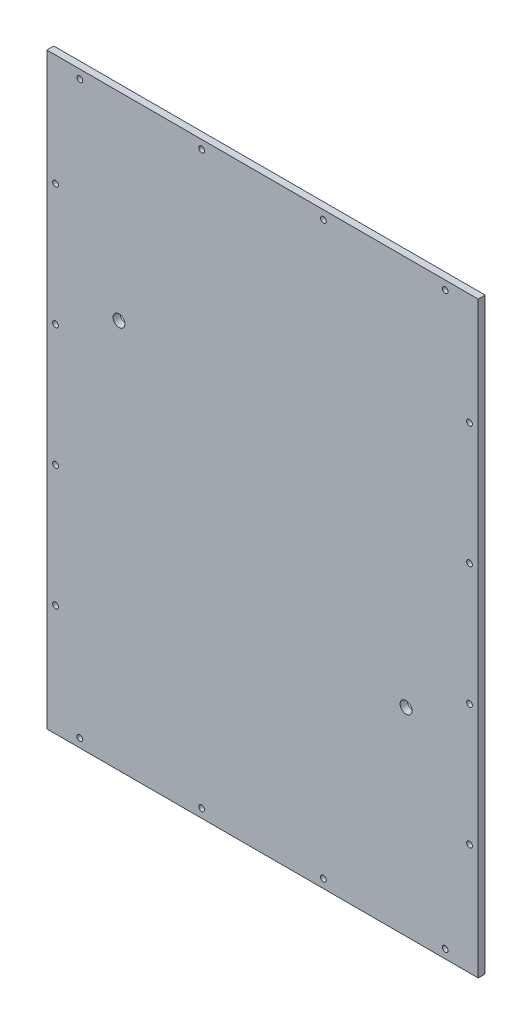
from build123d import *

# Parameters (mm, degrees)
SKETCH1_W                       = 260
SKETCH1_H                       = 350
BOSS_EXTRUDE1_DEPTH             = 58
FILLET1_R                       = 54
SKIZZE1_W                       = 260
SKIZZE1_H                       = 350
SKIZZE1_W_2                     = 248
SKIZZE1_H_2                     = 338
SCHNITT_LINEAR_AUSTRAGEN1_DEPTH = 4
M4_TAPPED_HOLE1_AT_2_COUNT      = 2
M4_TAPPED_HOLE1_AT_2_PITCH      = 70
M4_TAPPED_HOLE1_AT_3_COUNT      = 2
M4_TAPPED_HOLE1_AT_3_PITCH      = 60.638271743
M4_TAPPED_HOLE1_AT_4_COUNT      = 2
M4_TAPPED_HOLE1_AT_4_PITCH      = 129.757466067
SKETCH2_W                       = 260
SKETCH2_H                       = 350
CUT_EXTRUDE1_DEPTH              = 225.590738901
M8_TAPPED_HOLE1_D               = 6.8
CIRPATTERN1_COUNT               = 2


with BuildPart() as part:
    # Sketch1 → Boss-Extrude1 (new body)
    with BuildSketch(Plane.XY):
        Rectangle(SKETCH1_W, SKETCH1_H)
    extrude(amount=BOSS_EXTRUDE1_DEPTH)

    # Fillet1
    fillet1_edges = [part.edges().sort_by_distance(p)[0] for p in [
        (-130, 0, 58),
        (0, -175, 58),
        (130, 0, 58),
        (0, 175, 58),
    ]]
    fillet(fillet1_edges, radius=FILLET1_R)

    # Skizze1 → Schnitt-Linear austragen1 (cut)
    with BuildSketch(Plane(origin=(0, 0, 0), x_dir=(-1, 0, 0), z_dir=(0, 0, -1))):
        Rectangle(SKIZZE1_W, SKIZZE1_H)
        Rectangle(SKIZZE1_W_2, SKIZZE1_H_2, mode=Mode.SUBTRACT)
    extrude(amount=-SCHNITT_LINEAR_AUSTRAGEN1_DEPTH, mode=Mode.SUBTRACT)

    # Skizze2 → M4 Tapped Hole1 (revolve, cut)
    with BuildSketch(Plane(origin=(105, 164, 0), x_dir=(0, 1, 0), z_dir=(1, 0, 0))):
        Polygon((0, 0), (0, 12.491420021), (1.65, 11.5), (1.65, 0), align=None)
    m4_tapped_hole1 = revolve(axis=Axis((105, 164, -6.35), (0, 0, 1)), mode=Mode.SUBTRACT)

    # M4 Tapped Hole1 at 2: M4 Tapped Hole1 ×2
    with Locations(*[(-i * M4_TAPPED_HOLE1_AT_2_PITCH, 0, 0) for i in range(1, M4_TAPPED_HOLE1_AT_2_COUNT)]):
        add(m4_tapped_hole1, mode=Mode.SUBTRACT)

    # M4 Tapped Hole1 at 3: M4 Tapped Hole1 ×2
    with Locations(*[Vector(0.23087729246792194, -0.9729828754005292, 0) * (i * M4_TAPPED_HOLE1_AT_3_PITCH) for i in range(1, M4_TAPPED_HOLE1_AT_3_COUNT)]):
        add(m4_tapped_hole1, mode=Mode.SUBTRACT)

    # M4 Tapped Hole1 at 4: M4 Tapped Hole1 ×2
    with Locations(*[Vector(0.10789359891495286, -0.9941624471449217, 0) * (i * M4_TAPPED_HOLE1_AT_4_PITCH) for i in range(1, M4_TAPPED_HOLE1_AT_4_COUNT)]):
        add(m4_tapped_hole1, mode=Mode.SUBTRACT)

    # Spiegeln1: M4 Tapped Hole1 across plane
    add(m4_tapped_hole1.mirror(Plane.ZX), mode=Mode.SUBTRACT)

    # Spiegeln1 copy 1 sketch → Spiegeln1 copy 1 (revolve, cut)
    with BuildSketch(Plane(origin=(35, -164, 0), x_dir=(0, -1, 0), z_dir=(1, 0, 0))):
        Polygon((0, 0), (0, -12.491420021), (1.65, -11.5), (1.65, 0), align=None)
    revolve(axis=Axis((35, -164, -6.35), (0, 0, -1)), mode=Mode.SUBTRACT)

    # Spiegeln1 copy 2 sketch → Spiegeln1 copy 2 (revolve, cut)
    with BuildSketch(Plane(origin=(119, -105, 0), x_dir=(0, -1, 0), z_dir=(1, 0, 0))):
        Polygon((0, 0), (0, -12.491420021), (1.65, -11.5), (1.65, 0), align=None)
    revolve(axis=Axis((119, -105, -6.35), (0, 0, -1)), mode=Mode.SUBTRACT)

    # Spiegeln1 copy 3 sketch → Spiegeln1 copy 3 (revolve, cut)
    with BuildSketch(Plane(origin=(119, -35, 0), x_dir=(0, -1, 0), z_dir=(1, 0, 0))):
        Polygon((0, 0), (0, -12.491420021), (1.65, -11.5), (1.65, 0), align=None)
    revolve(axis=Axis((119, -35, -6.35), (0, 0, -1)), mode=Mode.SUBTRACT)

    # Spiegeln2: M4 Tapped Hole1 across plane
    add(m4_tapped_hole1.mirror(Plane(origin=(0, 0, 0), x_dir=(0, 0, 1), z_dir=(1, 0, 0))), mode=Mode.SUBTRACT)

    # Spiegeln2 copy 1 sketch → Spiegeln2 copy 1 (revolve, cut)
    with BuildSketch(Plane(origin=(-35, 164, 0), x_dir=(0, 1, 0), z_dir=(-1, 0, 0))):
        Polygon((0, 0), (0, -12.491420021), (1.65, -11.5), (1.65, 0), align=None)
    revolve(axis=Axis((-35, 164, -6.35), (0, 0, -1)), mode=Mode.SUBTRACT)

    # Spiegeln2 copy 2 sketch → Spiegeln2 copy 2 (revolve, cut)
    with BuildSketch(Plane(origin=(-119, 105, 0), x_dir=(0, 1, 0), z_dir=(-1, 0, 0))):
        Polygon((0, 0), (0, -12.491420021), (1.65, -11.5), (1.65, 0), align=None)
    revolve(axis=Axis((-119, 105, -6.35), (0, 0, -1)), mode=Mode.SUBTRACT)

    # Spiegeln2 copy 3 sketch → Spiegeln2 copy 3 (revolve, cut)
    with BuildSketch(Plane(origin=(-119, 35, 0), x_dir=(0, 1, 0), z_dir=(-1, 0, 0))):
        Polygon((0, 0), (0, -12.491420021), (1.65, -11.5), (1.65, 0), align=None)
    revolve(axis=Axis((-119, 35, -6.35), (0, 0, -1)), mode=Mode.SUBTRACT)

    # Spiegeln2 copy 4 sketch → Spiegeln2 copy 4 (revolve, cut)
    with BuildSketch(Plane(origin=(-105, -164, 0), x_dir=(0, -1, 0), z_dir=(-1, 0, 0))):
        Polygon((0, 0), (0, 12.491420021), (1.65, 11.5), (1.65, 0), align=None)
    revolve(axis=Axis((-105, -164, -6.35), (0, 0, 1)), mode=Mode.SUBTRACT)

    # Spiegeln2 copy 5 sketch → Spiegeln2 copy 5 (revolve, cut)
    with BuildSketch(Plane(origin=(-35, -164, 0), x_dir=(0, -1, 0), z_dir=(-1, 0, 0))):
        Polygon((0, 0), (0, 12.491420021), (1.65, 11.5), (1.65, 0), align=None)
    revolve(axis=Axis((-35, -164, -6.35), (0, 0, 1)), mode=Mode.SUBTRACT)

    # Spiegeln2 copy 6 sketch → Spiegeln2 copy 6 (revolve, cut)
    with BuildSketch(Plane(origin=(-119, -105, 0), x_dir=(0, -1, 0), z_dir=(-1, 0, 0))):
        Polygon((0, 0), (0, 12.491420021), (1.65, 11.5), (1.65, 0), align=None)
    revolve(axis=Axis((-119, -105, -6.35), (0, 0, 1)), mode=Mode.SUBTRACT)

    # Spiegeln2 copy 7 sketch → Spiegeln2 copy 7 (revolve, cut)
    with BuildSketch(Plane(origin=(-119, -35, 0), x_dir=(0, -1, 0), z_dir=(-1, 0, 0))):
        Polygon((0, 0), (0, 12.491420021), (1.65, 11.5), (1.65, 0), align=None)
    revolve(axis=Axis((-119, -35, -6.35), (0, 0, 1)), mode=Mode.SUBTRACT)

    # Sketch2 → Cut-Extrude1 (cut, through all)
    with BuildSketch(Plane(origin=(0, 0, 4), x_dir=(-1, 0, 0), z_dir=(0, 0, -1))):
        Rectangle(SKETCH2_W, SKETCH2_H)
    extrude(amount=-CUT_EXTRUDE1_DEPTH, mode=Mode.SUBTRACT)

    # M8 Tapped Hole1 (through all)
    with Locations(Plane(origin=(0, 0, 0), x_dir=(-1, 0, 0), z_dir=(0, 0, -1))):
        with Locations((-82.5, -55)):
            m8_tapped_hole1 = Hole(M8_TAPPED_HOLE1_D / 2)

    # CirPattern1: M8 Tapped Hole1 ×2 about axis
    cirpattern1_axis = Axis((0, 0, -0.2), (0, 0, 1))
    for i in range(1, CIRPATTERN1_COUNT):
        add(m8_tapped_hole1.rotate(cirpattern1_axis, i * 360 / CIRPATTERN1_COUNT), mode=Mode.SUBTRACT)


solid = part.part
